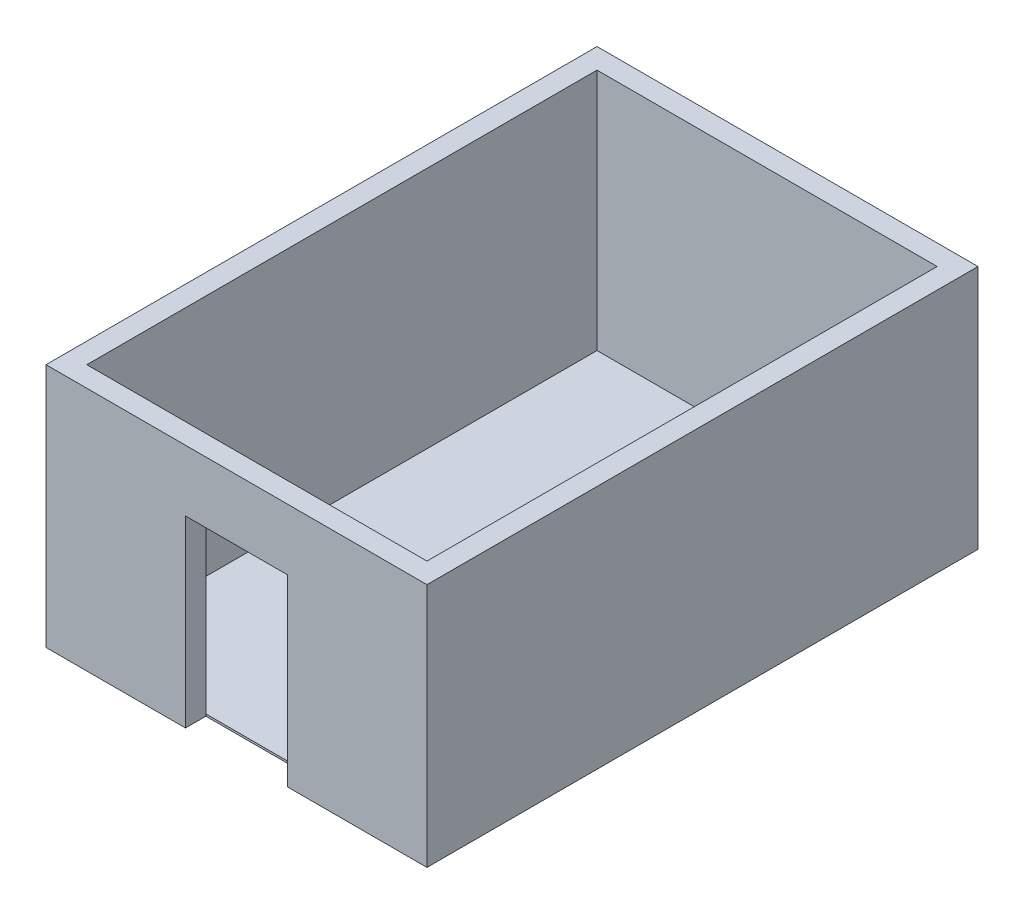
from build123d import *

# Parameters (mm, degrees)
SKETCH1_W           = 474.133333334
SKETCH1_H           = 685.8
SKETCH1_W_2         = 423.333333334
SKETCH1_H_2         = 635
EXTRUDE_THIN1_DEPTH = 304.8
SKETCH1_2_W         = 423.333333334
SKETCH1_2_H         = 635
BOSS_EXTRUDE1_DEPTH = 2.54
SKETCH2_W           = 127
SKETCH2_H           = 228.6
CUT_EXTRUDE1_DEPTH  = 25.4


with BuildPart() as part:
    # Sketch1 → Extrude-Thin1 (new body)
    with BuildSketch(Plane(origin=(0, 0, 0), x_dir=(1, 0, 0), z_dir=(0, 1, 0))):
        Rectangle(SKETCH1_W, SKETCH1_H)
        Rectangle(SKETCH1_W_2, SKETCH1_H_2, mode=Mode.SUBTRACT)
    extrude(amount=EXTRUDE_THIN1_DEPTH)

    # Sketch1<2> → Boss-Extrude1 (add)
    with BuildSketch(Plane(origin=(0, 0, 0), x_dir=(1, 0, 0), z_dir=(0, 1, 0))):
        Rectangle(SKETCH1_2_W, SKETCH1_2_H)
    extrude(amount=BOSS_EXTRUDE1_DEPTH)

    # Sketch2 → Cut-Extrude1 (cut)
    with BuildSketch(Plane.XY.offset(342.9)):
        with Locations((0, 114.3)):
            Rectangle(SKETCH2_W, SKETCH2_H)
    extrude(amount=-CUT_EXTRUDE1_DEPTH, mode=Mode.SUBTRACT)


solid = part.part
